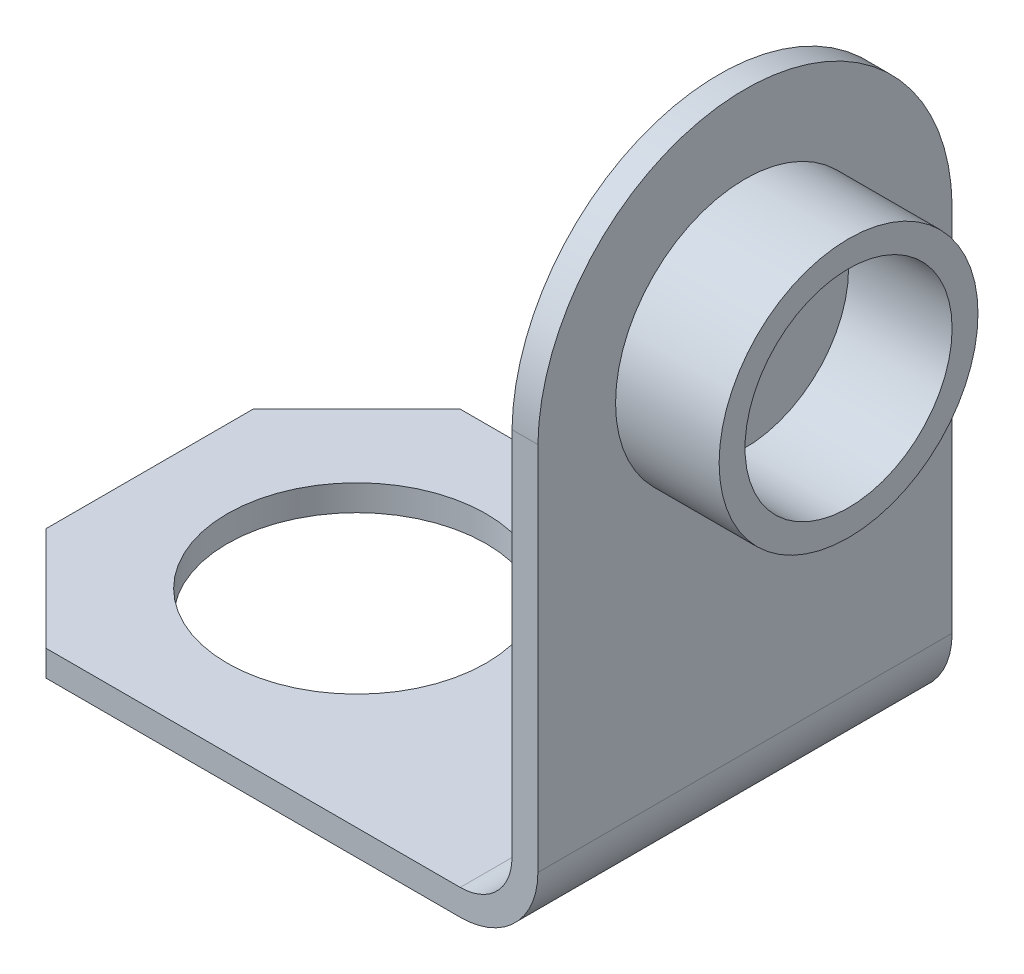
from build123d import *

# Parameters (mm, degrees)
BOSS_EXTRUDE1_DEPTH     = 40
CUT_EXTRUDE2_DEPTH      = 95.20854526
SKETCH2_4_R             = 12.5
SKETCH2_4_R_2           = 10
BOSS_EXTRUDE2_DEPTH     = 10
CHAMFER1_SIZE           = 10
CUT_EXTRUDE3_DEPTH      = 100.078251902
CUT_EXTRUDE3_DEPTH_BACK = 100.078251902
SKETCH3_R               = 12.5


with BuildPart() as part:
    # Sketch1 → Boss-Extrude1 (new body)
    with BuildSketch(Plane.XY):
        with BuildLine():
            Line((0, 0), (50, 0))
            ThreePointArc((50, 0), (55.303300859, 2.196699141), (57.5, 7.5))
            Line((57.5, 7.5), (57.5, 63))
            Line((57.5, 63), (55, 63))
            Line((55, 63), (55, 7.5))
            ThreePointArc((55, 7.5), (53.535533906, 3.964466094), (50, 2.5))
            Line((50, 2.5), (0, 2.5))
            Line((0, 2.5), (0, 0))
        make_face()
    extrude(amount=-BOSS_EXTRUDE1_DEPTH)

    # Sketch2 → Cut-Extrude2 (cut, through all)
    with BuildSketch(Plane(origin=(57.5, 0, 0), x_dir=(0, 0, -1), z_dir=(1, 0, 0))):
        with BuildLine():
            Line((0, 63), (0, 43.281023868))
            ThreePointArc((0, 43.281023868), (5.956869832, 57.241262542), (20, 63))
            Line((20, 63), (0, 63))
        make_face()
        with BuildLine():
            Line((40, 63), (20, 63))
            ThreePointArc((20, 63), (34.043130168, 57.241262542), (40, 43.281023868))
            Line((40, 43.281023868), (40, 63))
        make_face()
    extrude(amount=-CUT_EXTRUDE2_DEPTH, mode=Mode.SUBTRACT)

    # Sketch2<4> → Boss-Extrude2 (add)
    with BuildSketch(Plane(origin=(57.5, 0, 0), x_dir=(0, 0, -1), z_dir=(1, 0, 0))):
        with Locations((20, 42.997997502)):
            Circle(SKETCH2_4_R)
        with Locations((20, 42.997997502)):
            Circle(SKETCH2_4_R_2, mode=Mode.SUBTRACT)
    extrude(amount=BOSS_EXTRUDE2_DEPTH)

    # Chamfer1
    chamfer1_edges = [part.edges().sort_by_distance(p)[0] for p in [
        (0, 1.25, -40),
        (0, 1.25, 0),
    ]]
    chamfer(chamfer1_edges, length=CHAMFER1_SIZE)

    # Sketch3 → Cut-Extrude3 (cut, two sides: drawn at the far end of the back side and taken through both)
    with BuildSketch(Plane(origin=(0, 2.5, 0), x_dir=(1, 0, 0), z_dir=(0, 1, 0)).offset(-CUT_EXTRUDE3_DEPTH_BACK)):
        with Locations((20, 20)):
            Circle(SKETCH3_R)
    extrude(amount=CUT_EXTRUDE3_DEPTH + CUT_EXTRUDE3_DEPTH_BACK, mode=Mode.SUBTRACT)


solid = part.part
